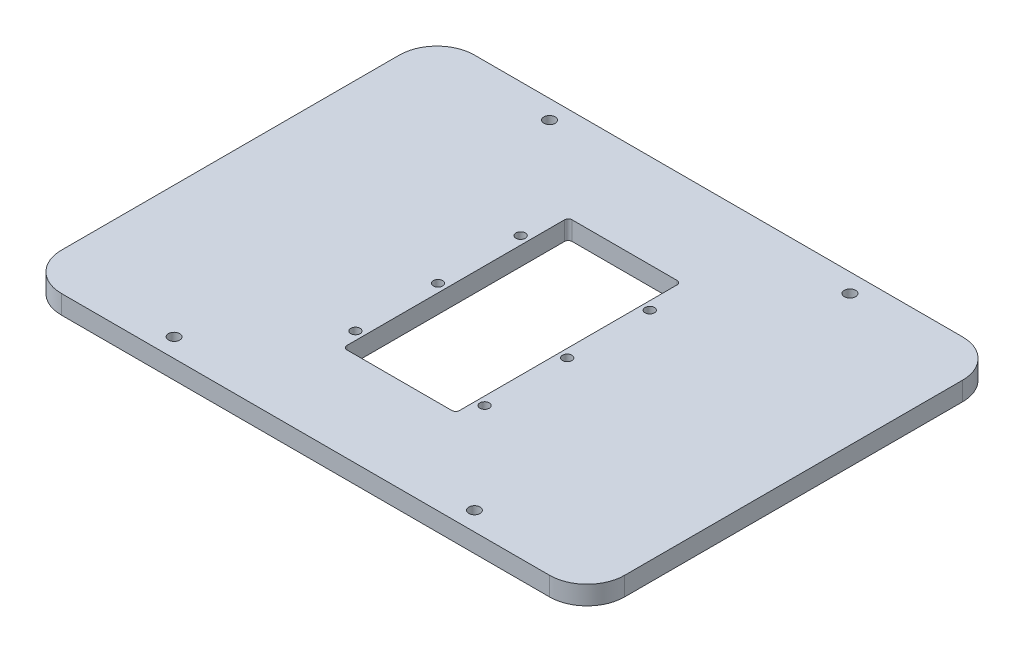
from build123d import *

# Parameters (mm, degrees)
ESBO_O1_R                = 1.5
ESBO_O1_R_2              = 1.25
RESSALTO_EXTRUS_O1_DEPTH = 5


with BuildPart() as part:
    # Esboço1 → Ressalto-extrusão1 (new body)
    with BuildSketch(Plane(origin=(0, 0, 0), x_dir=(1, 0, 0), z_dir=(0, 1, 0))):
        with BuildLine():
            Line((65, -55), (-65, -55))
            ThreePointArc((-65, -55), (-72.071067812, -52.071067812), (-75, -45))
            Line((-75, -45), (-75, 45))
            ThreePointArc((-75, 45), (-72.071067812, 52.071067812), (-65, 55))
            Line((-65, 55), (65, 55))
            ThreePointArc((65, 55), (72.071067812, 52.071067812), (75, 45))
            Line((75, 45), (75, -45))
            ThreePointArc((75, -45), (72.071067812, -52.071067812), (65, -55))
        make_face()
        with Locations(Location((-40, -50, 0), (0, 0, 270))):
            Circle(ESBO_O1_R, mode=Mode.SUBTRACT)
        with Locations(Location((40, -50, 0), (0, 0, 270))):
            Circle(ESBO_O1_R, mode=Mode.SUBTRACT)
        with Locations(Location((40, 50, 0), (0, 0, 90))):
            Circle(ESBO_O1_R, mode=Mode.SUBTRACT)
        with Locations(Location((-40, 50, 0), (0, 0, 90))):
            Circle(ESBO_O1_R, mode=Mode.SUBTRACT)
        with Locations(Location((17.2, 19.5, 0), (0, 0, 270))):
            Circle(ESBO_O1_R_2, mode=Mode.SUBTRACT)
        with Locations(Location((17.2, -2.5, 0), (0, 0, 270))):
            Circle(ESBO_O1_R_2, mode=Mode.SUBTRACT)
        with Locations(Location((17.2, -24.5, 0), (0, 0, 270))):
            Circle(ESBO_O1_R_2, mode=Mode.SUBTRACT)
        with Locations(Location((-17.2, -24.5, 0), (0, 0, 90))):
            Circle(ESBO_O1_R_2, mode=Mode.SUBTRACT)
        with Locations(Location((-17.2, -2.5, 0), (0, 0, 90))):
            Circle(ESBO_O1_R_2, mode=Mode.SUBTRACT)
        with Locations(Location((-17.2, 19.5, 0), (0, 0, 90))):
            Circle(ESBO_O1_R_2, mode=Mode.SUBTRACT)
        with BuildLine():
            Line((14, 30), (-14, 30))
            ThreePointArc((-14, 30), (-14.707106781, 29.707106781), (-15, 29))
            Line((-15, 29), (-15, -29))
            ThreePointArc((-15, -29), (-14.707106781, -29.707106781), (-14, -30))
            Line((-14, -30), (14, -30))
            ThreePointArc((14, -30), (14.707106781, -29.707106781), (15, -29))
            Line((15, -29), (15, 29))
            ThreePointArc((15, 29), (14.707106781, 29.707106781), (14, 30))
        make_face(mode=Mode.SUBTRACT)
    extrude(amount=RESSALTO_EXTRUS_O1_DEPTH)


solid = part.part
